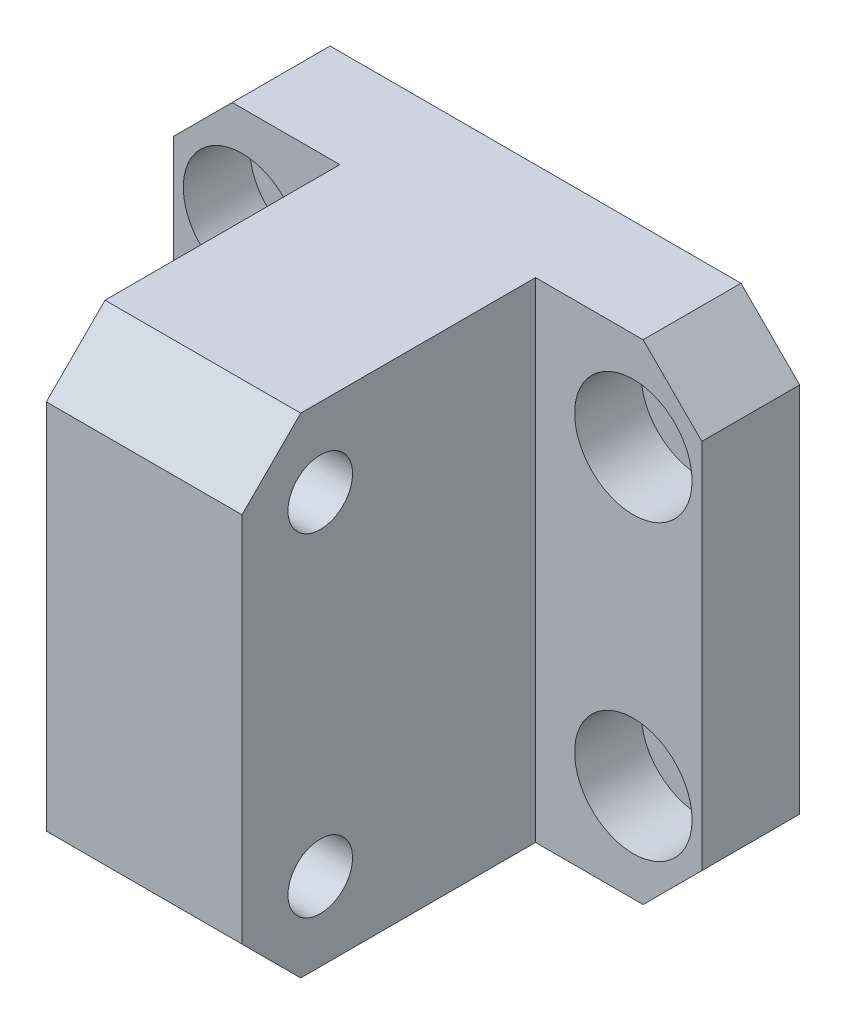
from build123d import *

# Parameters (mm, degrees)
SKETCH1_W                                            = 27
SKETCH1_H                                            = 25
BOSS_EXTRUDE1_DEPTH                                  = 5
SKETCH2_W                                            = 10
SKETCH2_H                                            = 25
BOSS_EXTRUDE2_DEPTH                                  = 15
CBORE_FOR_M3_HEXAGON_SOCKET_HEAD_CAP_SCR_D           = 3.4
CBORE_FOR_M3_HEXAGON_SOCKET_HEAD_CAP_SCR_CBORE_D     = 6
CBORE_FOR_M3_HEXAGON_SOCKET_HEAD_CAP_SCR_CBORE_DEPTH = 3.4
M4_TAPPED_HOLE1_D                                    = 3.3
CHAMFER1_SIZE                                        = 3


with BuildPart() as part:
    # Sketch1 → Boss-Extrude1 (new body)
    with BuildSketch(Plane.XY):
        Rectangle(SKETCH1_W, SKETCH1_H)
    extrude(amount=BOSS_EXTRUDE1_DEPTH)

    # Sketch2 → Boss-Extrude2 (add)
    with BuildSketch(Plane.XY.offset(5)):
        Rectangle(SKETCH2_W, SKETCH2_H)
    extrude(amount=BOSS_EXTRUDE2_DEPTH)

    # CBORE for M3 Hexagon socket head cap screws1 (through all)
    with Locations(Plane.XY.offset(5)):
        with Locations((10, 7.5), (10, -7.5), (-10, -7.5), (-10, 7.5)):
            CounterBoreHole(CBORE_FOR_M3_HEXAGON_SOCKET_HEAD_CAP_SCR_D / 2, CBORE_FOR_M3_HEXAGON_SOCKET_HEAD_CAP_SCR_CBORE_D / 2, CBORE_FOR_M3_HEXAGON_SOCKET_HEAD_CAP_SCR_CBORE_DEPTH)

    # M4 Tapped Hole1 (through all)
    with Locations(Plane.ZY.offset(5)):
        with Locations((16, 8.5), (16, -8.5)):
            Hole(M4_TAPPED_HOLE1_D / 2)

    # Chamfer1
    chamfer1_edges = [part.edges().sort_by_distance(p)[0] for p in [
        (0, 12.5, 20),
        (0, -12.5, 20),
        (13.5, -12.5, 2.5),
        (-13.5, -12.5, 2.5),
        (-13.5, 12.5, 2.5),
        (13.5, 12.5, 2.5),
    ]]
    chamfer(chamfer1_edges, length=CHAMFER1_SIZE)


solid = part.part
